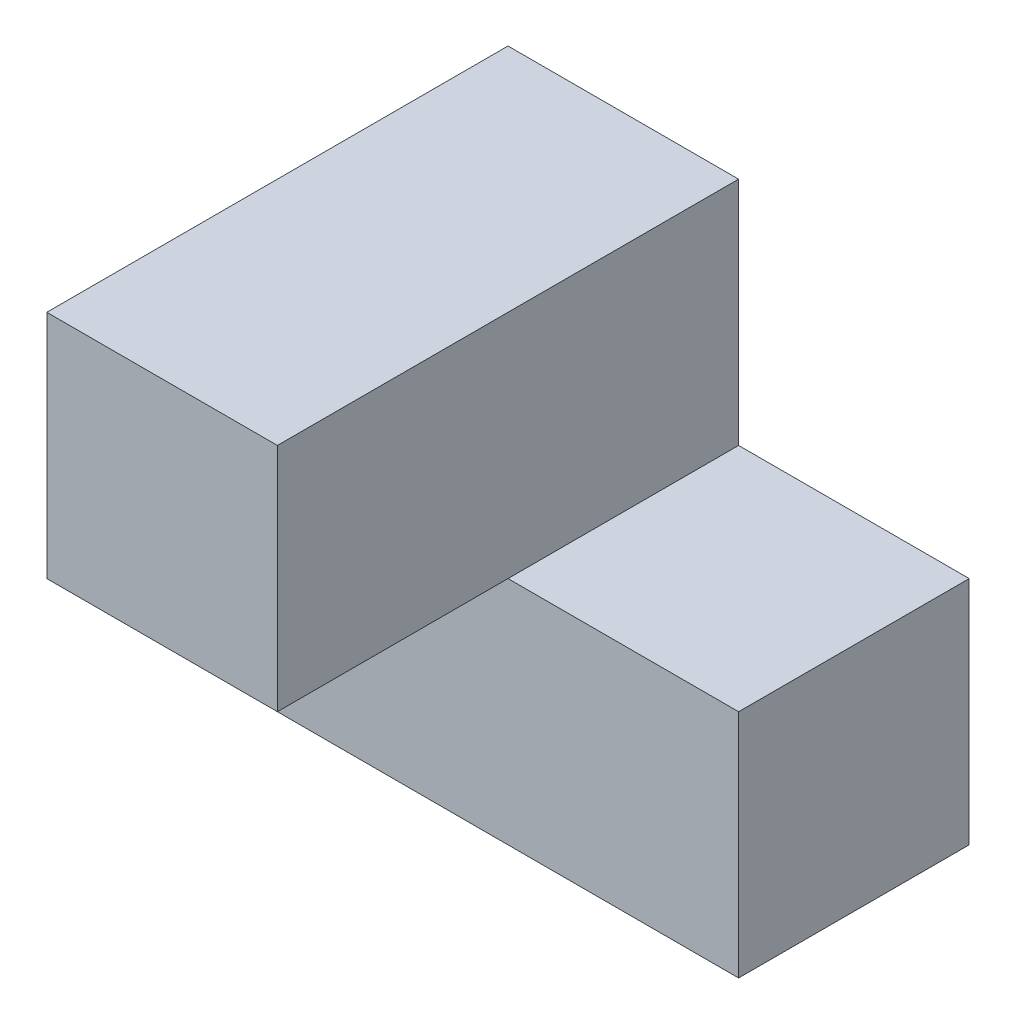
from build123d import *

# Parameters (mm, degrees)
ESQUISSE1_W        = 20
ESQUISSE1_H        = 10
BOSS_EXTRU_1_DEPTH = 10
ESQUISSE2_W        = 10
ESQUISSE2_H        = 10
BOSS_EXTRU_2_DEPTH = 20


with BuildPart() as part:
    # Esquisse1 → Boss.-Extru.1 (new body)
    with BuildSketch(Plane.XY):
        with Locations((10, 5)):
            Rectangle(ESQUISSE1_W, ESQUISSE1_H)
    extrude(amount=-BOSS_EXTRU_1_DEPTH)

    # Esquisse2 → Boss.-Extru.2 (add)
    with BuildSketch(Plane(origin=(0, 0, -10), x_dir=(-1, 0, 0), z_dir=(0, 0, -1))):
        with Locations((-5, 15)):
            Rectangle(ESQUISSE2_W, ESQUISSE2_H)
    extrude(amount=-BOSS_EXTRU_2_DEPTH)


solid = part.part
